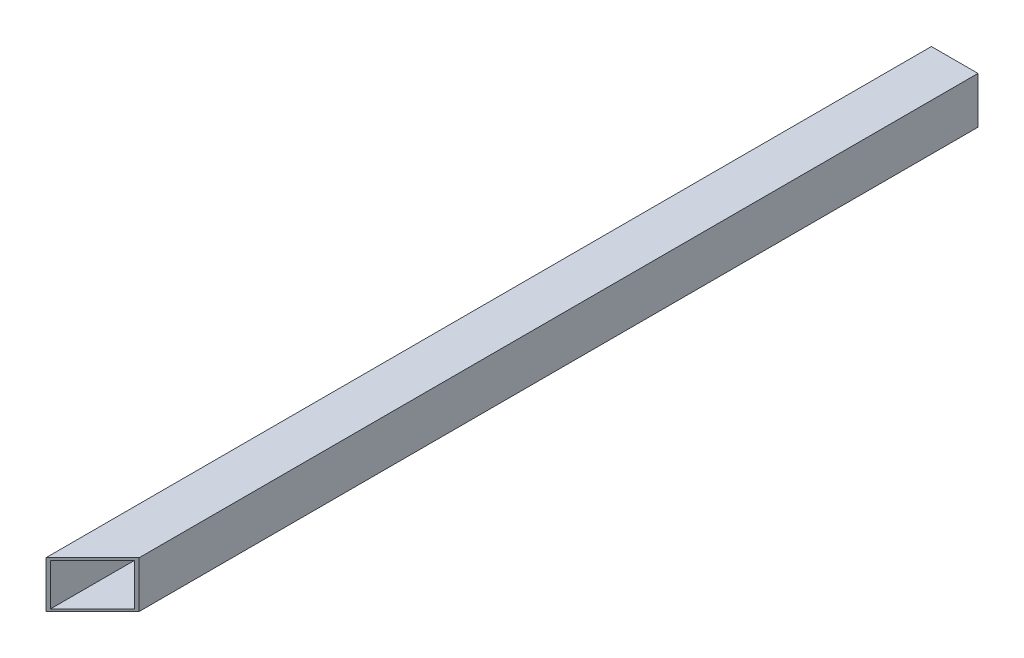
from build123d import *

# Parameters (mm, degrees)
SKETCH3_W           = 25.4
SKETCH3_H           = 25.4
SKETCH3_W_2         = 22.9108
SKETCH3_H_2         = 22.9108
BOSS_EXTRUDE1_DEPTH = 482.6
SKETCH4_W           = 25.4
SKETCH4_H           = 25.4
CUT_EXTRUDE1_DEPTH  = 482.6


with BuildPart() as part:
    # Sketch3 → Boss-Extrude1 (new body)
    with BuildSketch(Plane.XY):
        Rectangle(SKETCH3_W, SKETCH3_H)
        Rectangle(SKETCH3_W_2, SKETCH3_H_2, mode=Mode.SUBTRACT)
    extrude(amount=BOSS_EXTRUDE1_DEPTH)

    # Sketch4 → Cut-Extrude1 (cut)
    with BuildSketch(Plane(origin=(-247.65, 0, 247.65), x_dir=(0, -1, 0), z_dir=(-0.7071067811865488, 0, 0.7071067811865464))):
        with Locations((0, 344.96947648)):
            Rectangle(SKETCH4_W, SKETCH4_H)
    extrude(amount=-CUT_EXTRUDE1_DEPTH, mode=Mode.SUBTRACT)


solid = part.part
